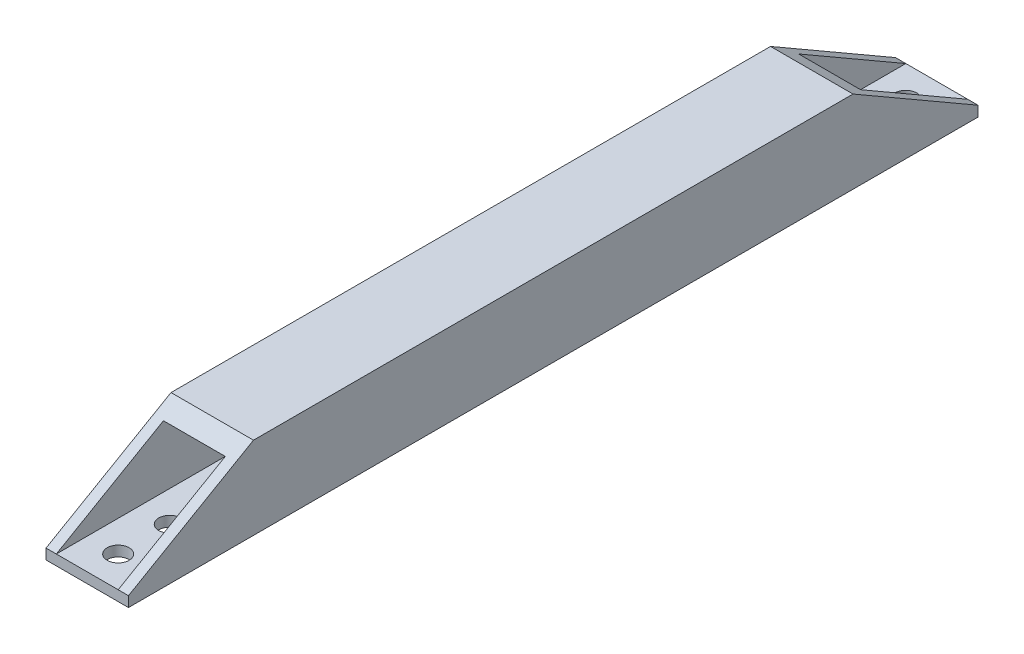
from build123d import *

# Parameters (mm, degrees)
SKETCH1_W           = 25.4
SKETCH1_H           = 25.4
SKETCH1_W_2         = 19.05
SKETCH1_H_2         = 19.05
BOSS_EXTRUDE1_DEPTH = 261.62
CUT_EXTRUDE2_DEPTH  = 264.156748726
SKETCH3_R           = 3.3734375
CUT_EXTRUDE3_DEPTH  = 264.156748726


with BuildPart() as part:
    # Sketch1 → Boss-Extrude1 (new body)
    with BuildSketch(Plane.XY):
        Rectangle(SKETCH1_W, SKETCH1_H)
        Rectangle(SKETCH1_W_2, SKETCH1_H_2, mode=Mode.SUBTRACT)
    extrude(amount=BOSS_EXTRUDE1_DEPTH)

    # Sketch2 → Cut-Extrude2 (cut, through all)
    with BuildSketch(Plane(origin=(12.7, 0, 0), x_dir=(0, 0, -1), z_dir=(1, 0, 0))):
        Polygon((-223.125170802, 12.7), (-261.62, -9.525), (-261.62, 12.7), align=None)
        Polygon((-38.494829198, 12.7), (0, -9.525), (0, 12.7), align=None)
    extrude(amount=-CUT_EXTRUDE2_DEPTH, mode=Mode.SUBTRACT)

    # Sketch3 → Cut-Extrude3 (cut, through all)
    with BuildSketch(Plane.XZ.offset(12.7)):
        with Locations(Location((0, 252.095, 0), (0, 0, 270))):
            Circle(SKETCH3_R)
        with Locations(Location((0, 236.22, 0), (0, 0, 270))):
            Circle(SKETCH3_R)
        with Locations(Location((0, 25.4, 0), (0, 0, 270))):
            Circle(SKETCH3_R)
        with Locations(Location((0, 9.525, 0), (0, 0, 270))):
            Circle(SKETCH3_R)
    extrude(amount=-CUT_EXTRUDE3_DEPTH, mode=Mode.SUBTRACT)


solid = part.part
